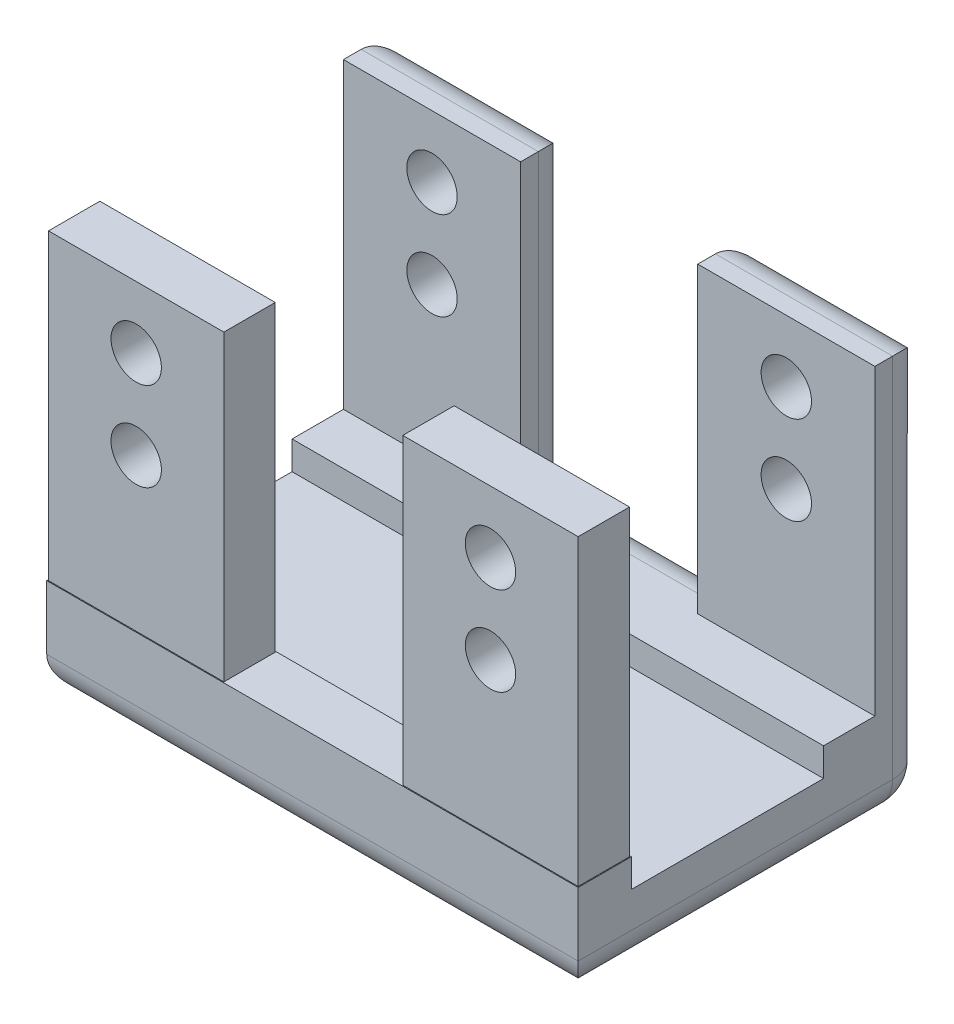
from build123d import *

# Parameters (mm, degrees)
SKETCH1_W           = 30
SKETCH1_H           = 19.75
BOSS_EXTRUDE1_DEPTH = 4
SKETCH2_W           = 30
SKETCH2_H           = 5.9
BOSS_EXTRUDE2_DEPTH = 1.601
SKETCH3_W           = 10
SKETCH3_H           = 3
BOSS_EXTRUDE3_DEPTH = 18.7
SKETCH4_W           = 10
SKETCH4_H           = 3
BOSS_EXTRUDE4_DEPTH = 17.099
SKETCH5_W           = 10
SKETCH5_H           = 3
BOSS_EXTRUDE5_DEPTH = 1.601
FILLET1_R           = 2
CUT_EXTRUDE1_REACH  = 43.181
SKETCH6_R           = 1.4224
CUT_EXTRUDE2_REACH  = 43.181
SKETCH7_R           = 1.4224
SKETCH8_W           = 10
SKETCH8_H           = 3
SKETCH8_W_2         = 9.9
SKETCH8_H_2         = 2.9
CUT_EXTRUDE3_DEPTH  = 17.099


with BuildPart() as part:
    # Sketch1 → Boss-Extrude1 (new body)
    with BuildSketch(Plane(origin=(0, 0, 0), x_dir=(1, 0, 0), z_dir=(0, 1, 0))):
        with Locations((15, 9.875)):
            Rectangle(SKETCH1_W, SKETCH1_H)
    extrude(amount=BOSS_EXTRUDE1_DEPTH)

    # Sketch2 → Boss-Extrude2 (add)
    with BuildSketch(Plane(origin=(0, 4, 0), x_dir=(1, 0, 0), z_dir=(0, 1, 0))):
        with Locations((15, 16.8)):
            Rectangle(SKETCH2_W, SKETCH2_H)
    extrude(amount=BOSS_EXTRUDE2_DEPTH)

    # Sketch3 → Boss-Extrude3 (add)
    with BuildSketch(Plane(origin=(0, 4, 0), x_dir=(1, 0, 0), z_dir=(0, 1, 0))):
        with Locations((5, 1.5)):
            Rectangle(SKETCH3_W, SKETCH3_H)
        with Locations((25, 1.5)):
            Rectangle(SKETCH3_W, SKETCH3_H)
    extrude(amount=BOSS_EXTRUDE3_DEPTH)

    # Sketch4 → Boss-Extrude4 (add)
    with BuildSketch(Plane(origin=(0, 5.601, 0), x_dir=(1, 0, 0), z_dir=(0, 1, 0))):
        with Locations((5, 18.25)):
            Rectangle(SKETCH4_W, SKETCH4_H)
        with Locations((25, 18.25)):
            Rectangle(SKETCH4_W, SKETCH4_H)
    extrude(amount=BOSS_EXTRUDE4_DEPTH)

    # Sketch5 → Boss-Extrude5 (add)
    with BuildSketch(Plane(origin=(0, 4, 0), x_dir=(1, 0, 0), z_dir=(0, 1, 0))):
        with Locations((15, 1.5)):
            Rectangle(SKETCH5_W, SKETCH5_H)
    extrude(amount=BOSS_EXTRUDE5_DEPTH)

    # Fillet1
    fillet1_edges = [part.edges().sort_by_distance(p)[0] for p in [
        (15, 0, -19.75),
        (30, 0, -9.875),
        (15, 0, 0),
        (10, 14.1505, -19.75),
        (5, 22.7, -19.75),
        (0, 0, -9.875),
        (15, 5.601, -19.75),
        (20, 14.1505, -19.75),
        (25, 22.7, -19.75),
        (0, 11.35, -19.75),
        (30, 11.35, -19.75),
    ]]
    fillet(fillet1_edges, radius=FILLET1_R)

    # Sketch6 → Cut-Extrude1 (cut, up to next)
    with BuildSketch(Plane.XY.offset(-16.75), mode=Mode.PRIVATE) as cut_extrude1_sk1:
        with Locations((5, 19.2)):
            Circle(SKETCH6_R)
    cut_extrude1_tool1 = extrude(cut_extrude1_sk1.sketch, amount=-CUT_EXTRUDE1_REACH, mode=Mode.PRIVATE) & part.part
    # Sketch6 → Cut-Extrude1 (cut, up to next)
    with BuildSketch(Plane.XY.offset(-16.75), mode=Mode.PRIVATE) as cut_extrude1_sk2:
        with Locations((25, 19.2)):
            Circle(SKETCH6_R)
    cut_extrude1_tool2 = extrude(cut_extrude1_sk2.sketch, amount=-CUT_EXTRUDE1_REACH, mode=Mode.PRIVATE) & part.part
    # Sketch6 → Cut-Extrude1 (cut, up to next)
    with BuildSketch(Plane.XY.offset(-16.75), mode=Mode.PRIVATE) as cut_extrude1_sk3:
        with Locations((5, 14.2)):
            Circle(SKETCH6_R)
    cut_extrude1_tool3 = extrude(cut_extrude1_sk3.sketch, amount=-CUT_EXTRUDE1_REACH, mode=Mode.PRIVATE) & part.part
    # Sketch6 → Cut-Extrude1 (cut, up to next)
    with BuildSketch(Plane.XY.offset(-16.75), mode=Mode.PRIVATE) as cut_extrude1_sk4:
        with Locations((25, 14.2)):
            Circle(SKETCH6_R)
    cut_extrude1_tool4 = extrude(cut_extrude1_sk4.sketch, amount=-CUT_EXTRUDE1_REACH, mode=Mode.PRIVATE) & part.part
    add(cut_extrude1_tool1.solids().sort_by_distance((5, 19.2, -16.75))[0], mode=Mode.SUBTRACT)
    add(cut_extrude1_tool2.solids().sort_by_distance((25, 19.2, -16.75))[0], mode=Mode.SUBTRACT)
    add(cut_extrude1_tool3.solids().sort_by_distance((5, 14.2, -16.75))[0], mode=Mode.SUBTRACT)
    add(cut_extrude1_tool4.solids().sort_by_distance((25, 14.2, -16.75))[0], mode=Mode.SUBTRACT)

    # Sketch7 → Cut-Extrude2 (cut, up to next)
    with BuildSketch(Plane(origin=(0, 0, -3), x_dir=(-1, 0, 0), z_dir=(0, 0, -1)), mode=Mode.PRIVATE) as cut_extrude2_sk1:
        with Locations(Location((-25, 19.2, 0), (0, 0, 180))):
            Circle(SKETCH7_R)
    cut_extrude2_tool1 = extrude(cut_extrude2_sk1.sketch, amount=-CUT_EXTRUDE2_REACH, mode=Mode.PRIVATE) & part.part
    # Sketch7 → Cut-Extrude2 (cut, up to next)
    with BuildSketch(Plane(origin=(0, 0, -3), x_dir=(-1, 0, 0), z_dir=(0, 0, -1)), mode=Mode.PRIVATE) as cut_extrude2_sk2:
        with Locations(Location((-5, 19.2, 0), (0, 0, 180))):
            Circle(SKETCH7_R)
    cut_extrude2_tool2 = extrude(cut_extrude2_sk2.sketch, amount=-CUT_EXTRUDE2_REACH, mode=Mode.PRIVATE) & part.part
    # Sketch7 → Cut-Extrude2 (cut, up to next)
    with BuildSketch(Plane(origin=(0, 0, -3), x_dir=(-1, 0, 0), z_dir=(0, 0, -1)), mode=Mode.PRIVATE) as cut_extrude2_sk3:
        with Locations(Location((-5, 14.2, 0), (0, 0, 180))):
            Circle(SKETCH7_R)
    cut_extrude2_tool3 = extrude(cut_extrude2_sk3.sketch, amount=-CUT_EXTRUDE2_REACH, mode=Mode.PRIVATE) & part.part
    # Sketch7 → Cut-Extrude2 (cut, up to next)
    with BuildSketch(Plane(origin=(0, 0, -3), x_dir=(-1, 0, 0), z_dir=(0, 0, -1)), mode=Mode.PRIVATE) as cut_extrude2_sk4:
        with Locations(Location((-25, 14.2, 0), (0, 0, 180))):
            Circle(SKETCH7_R)
    cut_extrude2_tool4 = extrude(cut_extrude2_sk4.sketch, amount=-CUT_EXTRUDE2_REACH, mode=Mode.PRIVATE) & part.part
    add(cut_extrude2_tool1.solids().sort_by_distance((25, 19.2, -3))[0], mode=Mode.SUBTRACT)
    add(cut_extrude2_tool2.solids().sort_by_distance((5, 19.2, -3))[0], mode=Mode.SUBTRACT)
    add(cut_extrude2_tool3.solids().sort_by_distance((5, 14.2, -3))[0], mode=Mode.SUBTRACT)
    add(cut_extrude2_tool4.solids().sort_by_distance((25, 14.2, -3))[0], mode=Mode.SUBTRACT)

    # Sketch8 → Cut-Extrude3 (cut)
    # profile 1 of 2: a face of its own
    with BuildSketch(Plane(origin=(0, 22.7, 0), x_dir=(1, 0, 0), z_dir=(0, 1, 0))):
        with Locations((5, 1.5)):
            Rectangle(SKETCH8_W, SKETCH8_H)
        with Locations((5, 1.5)):
            Rectangle(SKETCH8_W_2, SKETCH8_H_2, mode=Mode.SUBTRACT)
    # profile 2 of 2: a face of its own
    with BuildSketch(Plane(origin=(0, 22.7, 0), x_dir=(1, 0, 0), z_dir=(0, 1, 0))):
        with Locations((25, 1.5)):
            Rectangle(SKETCH8_W, SKETCH8_H)
        with Locations((25, 1.5)):
            Rectangle(SKETCH8_W_2, SKETCH8_H_2, mode=Mode.SUBTRACT)
    extrude(amount=-CUT_EXTRUDE3_DEPTH, mode=Mode.SUBTRACT)


solid = part.part
